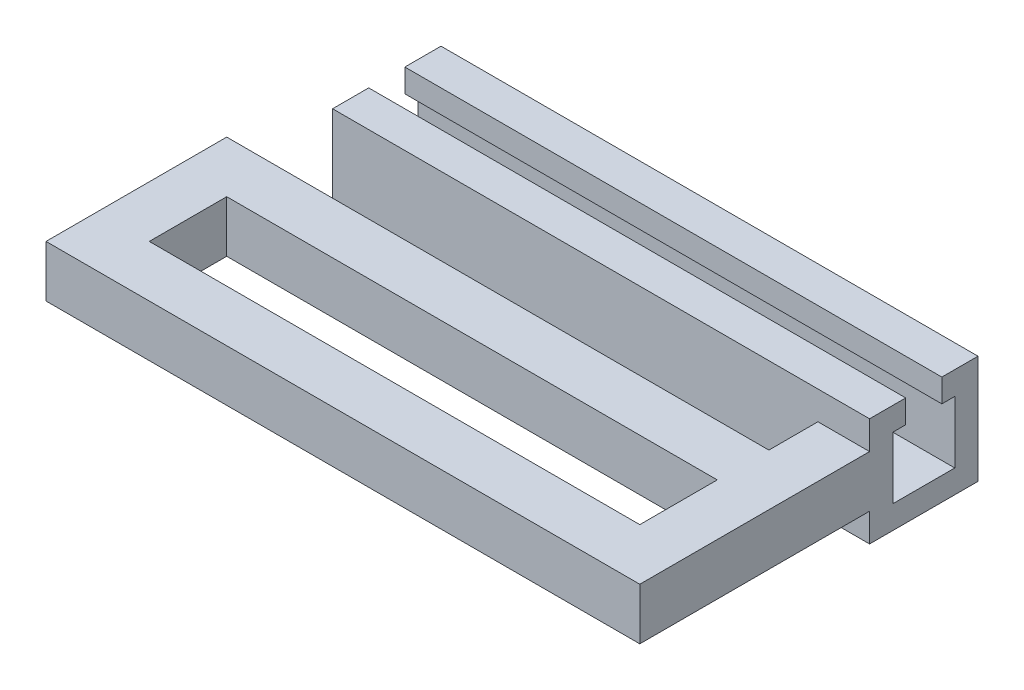
from build123d import *

# Parameters (mm, degrees)
ESBO_O1_W                = 19
ESBO_O1_H                = 3
RESSALTO_EXTRUS_O1_DEPTH = 2
ESBO_O3_W                = 2.338389472
ESBO_O3_H                = 3.565642473
CORTE_EXTRUS_O2_DEPTH    = 3
ESBO_O4_W                = 4.2
ESBO_O4_H                = 4.2
ESBO_O4_W_2              = 2.2
ESBO_O4_H_2              = 2.2
RESSALTO_EXTRUS_O2_DEPTH = 21
ESBO_O5_W                = 2
ESBO_O5_H                = 2
CORTE_EXTRUS_O3_DEPTH    = 29
ESBO_O6_W                = 10.73629406
ESBO_O6_H                = 11.045994849
CORTE_EXTRUS_O4_DEPTH    = 4.5
CORTE_EXTRUS_O5_DEPTH    = 24


with BuildPart() as part:
    # Esboço1 → Ressalto-extrusão1 (new body)
    with BuildSketch(Plane(origin=(0, 0, 0), x_dir=(1, 0, 0), z_dir=(0, 1, 0))):
        Polygon((-10.479474548, 11.375), (12.520525452, 11.375), (12.520525452, -0.625), (10.520525452, -0.625), (-10.479474548, -0.625), (-10.479474548, 6.375), (10.520525452, 6.375), (10.520525452, 9.375), (-10.479474548, 9.375), align=None)
        with Locations((1.020525452, 2.875)):
            Rectangle(ESBO_O1_W, ESBO_O1_H, mode=Mode.SUBTRACT)
    extrude(amount=RESSALTO_EXTRUS_O1_DEPTH)

    # Esboço3 → Corte-extrusão2 (cut)
    with BuildSketch(Plane(origin=(0, 0, 0), x_dir=(1, 0, 0), z_dir=(0, 1, 0))):
        with Locations((-9.648669284, 10.261118249)):
            Rectangle(ESBO_O3_W, ESBO_O3_H)
    extrude(amount=CORTE_EXTRUS_O2_DEPTH, mode=Mode.SUBTRACT)

    # Esboço4 → Ressalto-extrusão2 (add)
    with BuildSketch(Plane.ZY.offset(8.479474548)):
        with Locations((-10.375, 1)):
            Rectangle(ESBO_O4_W, ESBO_O4_H)
        with Locations((-10.375, 1)):
            Rectangle(ESBO_O4_W_2, ESBO_O4_H_2, mode=Mode.SUBTRACT)
    extrude(amount=-RESSALTO_EXTRUS_O2_DEPTH)

    # Esboço5 → Corte-extrusão3 (cut)
    with BuildSketch(Plane.ZY.offset(8.479474548)):
        with Locations((-10.375, 1)):
            Rectangle(ESBO_O5_W, ESBO_O5_H)
    extrude(amount=-CORTE_EXTRUS_O3_DEPTH, mode=Mode.SUBTRACT)

    # Esboço6 → Corte-extrusão4 (cut, symmetric)
    with BuildSketch(Plane(origin=(0, 0, 0), x_dir=(1, 0, 0), z_dir=(0, 1, 0))):
        with Locations((-13.647621578, 13.152356314)):
            Rectangle(ESBO_O6_W, ESBO_O6_H)
    extrude(amount=CORTE_EXTRUS_O4_DEPTH, both=True, mode=Mode.SUBTRACT)

    # Esboço7 → Corte-extrusão5 (cut)
    with BuildSketch(Plane.ZY.offset(8.279474548)):
        Polygon((-11.075, 2.2), (-11.075, 3.370047827), (-9.675, 3.370047827), (-9.675, 2.2), (-9.175, 2.2), (-9.175, -0.2), (-11.575, -0.2), (-11.575, 2.2), align=None)
    extrude(amount=-CORTE_EXTRUS_O5_DEPTH, mode=Mode.SUBTRACT)


solid = part.part
